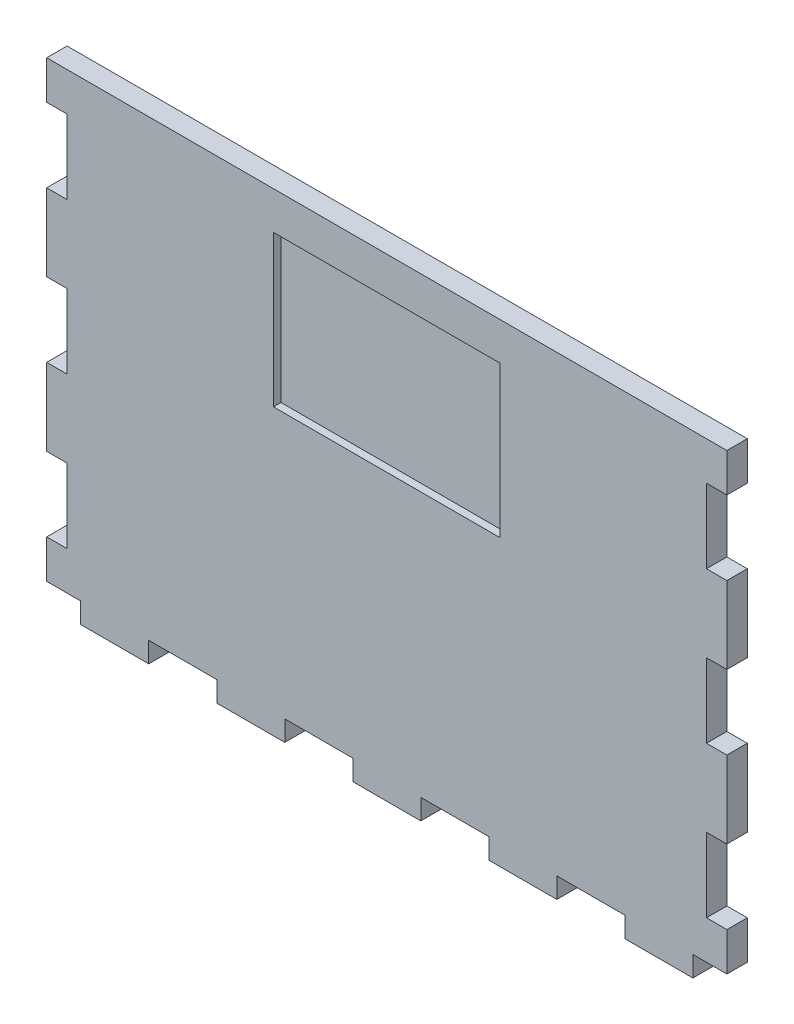
from build123d import *

# Parameters (mm, degrees)
ESQUISSE1_W                    = 90
ESQUISSE1_H                    = 60
BOSS_EXTRU_1_DEPTH             = 2.7
ESQUISSE2_W                    = 9
ESQUISSE2_H                    = 2.7
BOSS_EXTRU_2_DEPTH             = 2.7
R_P_TITION_LIN_AIRE1_COUNT     = 3
R_P_TITION_LIN_AIRE1_PITCH     = 18
R_P_TITION_LIN_AIRE1_COL_COUNT = 3
R_P_TITION_LIN_AIRE1_COL_PITCH = 18
ESQUISSE3_W                    = 2.7
ESQUISSE3_H                    = 9.8
ENL_V_MAT_EXTRU_1_DEPTH        = 2.7
R_P_TITION_LIN_AIRE2_COUNT     = 5
R_P_TITION_LIN_AIRE2_PITCH     = 20
SYM_TRIE1_COPY_1_SKETCH_W      = 2.7
SYM_TRIE1_COPY_1_SKETCH_H      = 9.8
SYM_TRIE1_COPY_1_DEPTH         = 2.7
SYM_TRIE1_COPY_2_SKETCH_W      = 2.7
SYM_TRIE1_COPY_2_SKETCH_H      = 9.8
SYM_TRIE1_COPY_2_DEPTH         = 2.7
SYM_TRIE1_COPY_3_SKETCH_W      = 2.7
SYM_TRIE1_COPY_3_SKETCH_H      = 9.8
SYM_TRIE1_COPY_3_DEPTH         = 2.7
SYM_TRIE1_COPY_4_SKETCH_W      = 2.7
SYM_TRIE1_COPY_4_SKETCH_H      = 9.8
SYM_TRIE1_COPY_4_DEPTH         = 2.7
ESQUISSE14_W                   = 30
ESQUISSE14_H                   = 20
ENL_V_MAT_EXTRU_4_DEPTH        = 1


with BuildPart() as part:
    # Esquisse1 → Boss.-Extru.1 (new body)
    with BuildSketch(Plane.XY):
        with Locations((0, -30)):
            Rectangle(ESQUISSE1_W, ESQUISSE1_H)
    extrude(amount=BOSS_EXTRU_1_DEPTH)

    # Esquisse2 → Boss.-Extru.2 (add)
    with BuildSketch(Plane.XY):
        with Locations((0, -61.35)):
            Rectangle(ESQUISSE2_W, ESQUISSE2_H)
    boss_extru_2 = extrude(amount=BOSS_EXTRU_2_DEPTH)

    # Répétition linéaire1: Boss.-Extru.2 ×3
    with Locations(*[(i * R_P_TITION_LIN_AIRE1_PITCH, 0, 0) for i in range(1, R_P_TITION_LIN_AIRE1_COUNT)]):
        add(boss_extru_2)

    # Répétition linéaire1 col: Boss.-Extru.2 ×3
    with Locations(*[(-i * R_P_TITION_LIN_AIRE1_COL_PITCH, 0, 0) for i in range(1, R_P_TITION_LIN_AIRE1_COL_COUNT)]):
        add(boss_extru_2)

    # Esquisse3 → Enlèv. mat.-Extru.1 (cut)
    with BuildSketch(Plane.XY):
        with Locations((43.65, -50)):
            Rectangle(ESQUISSE3_W, ESQUISSE3_H)
    enl_v_mat_extru_1 = extrude(amount=ENL_V_MAT_EXTRU_1_DEPTH, mode=Mode.SUBTRACT)

    # Répétition linéaire2: Enlèv. mat.-Extru.1 ×5
    with Locations(*[(0, i * R_P_TITION_LIN_AIRE2_PITCH, 0) for i in range(1, R_P_TITION_LIN_AIRE2_COUNT)]):
        add(enl_v_mat_extru_1, mode=Mode.SUBTRACT)

    # Symétrie1: Enlèv. mat.-Extru.1 across plane
    add(enl_v_mat_extru_1.mirror(Plane(origin=(0, 0, 0), x_dir=(0, 0, 1), z_dir=(1, 0, 0))), mode=Mode.SUBTRACT)

    # Symétrie1 copy 1 sketch → Symétrie1 copy 1 (cut)
    with BuildSketch(Plane(origin=(0, 20, 0), x_dir=(-1, 0, 0), z_dir=(0, 0, 1))):
        with Locations((43.65, 50)):
            Rectangle(SYM_TRIE1_COPY_1_SKETCH_W, SYM_TRIE1_COPY_1_SKETCH_H)
    extrude(amount=SYM_TRIE1_COPY_1_DEPTH, mode=Mode.SUBTRACT)

    # Symétrie1 copy 2 sketch → Symétrie1 copy 2 (cut)
    with BuildSketch(Plane(origin=(0, 40, 0), x_dir=(-1, 0, 0), z_dir=(0, 0, 1))):
        with Locations((43.65, 50)):
            Rectangle(SYM_TRIE1_COPY_2_SKETCH_W, SYM_TRIE1_COPY_2_SKETCH_H)
    extrude(amount=SYM_TRIE1_COPY_2_DEPTH, mode=Mode.SUBTRACT)

    # Symétrie1 copy 3 sketch → Symétrie1 copy 3 (cut)
    with BuildSketch(Plane(origin=(0, 60, 0), x_dir=(-1, 0, 0), z_dir=(0, 0, 1))):
        with Locations((43.65, 50)):
            Rectangle(SYM_TRIE1_COPY_3_SKETCH_W, SYM_TRIE1_COPY_3_SKETCH_H)
    extrude(amount=SYM_TRIE1_COPY_3_DEPTH, mode=Mode.SUBTRACT)

    # Symétrie1 copy 4 sketch → Symétrie1 copy 4 (cut)
    with BuildSketch(Plane(origin=(0, 80, 0), x_dir=(-1, 0, 0), z_dir=(0, 0, 1))):
        with Locations((43.65, 50)):
            Rectangle(SYM_TRIE1_COPY_4_SKETCH_W, SYM_TRIE1_COPY_4_SKETCH_H)
    extrude(amount=SYM_TRIE1_COPY_4_DEPTH, mode=Mode.SUBTRACT)

    # Esquisse14 → Enlèv. mat.-Extru.4 (cut)
    with BuildSketch(Plane.XY.offset(2.7)):
        with Locations((0, -15)):
            Rectangle(ESQUISSE14_W, ESQUISSE14_H)
    extrude(amount=-ENL_V_MAT_EXTRU_4_DEPTH, mode=Mode.SUBTRACT)


solid = part.part
